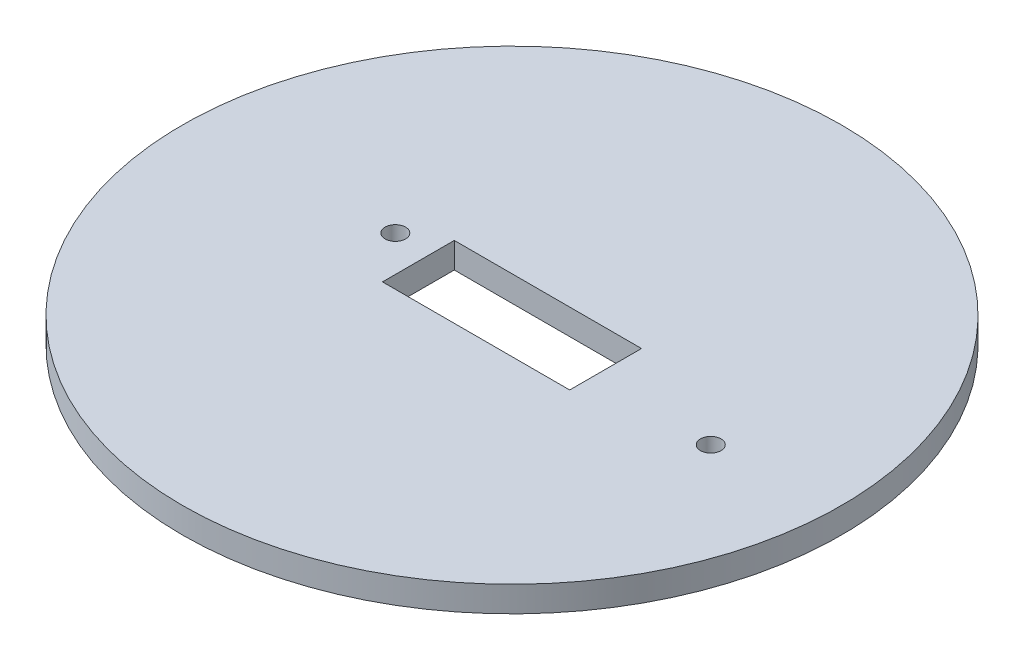
from build123d import *

# Parameters (mm, degrees)
SKETCH2_R                  = 25.7
BOSS_EXTRUDE1_DEPTH        = 2
SKETCH3_W                  = 14.6
SKETCH3_H                  = 5.6
CUT_EXTRUDE1_DEPTH         = 37.400274724
F_1_6_1_6_DIAMETER_HOLE1_D = 1.6


with BuildPart() as part:
    # Sketch2 → Boss-Extrude1 (new body)
    with BuildSketch(Plane(origin=(0, 0, 0), x_dir=(1, 0, 0), z_dir=(0, 1, 0))):
        with Locations(Location((0, 0, 0), (0, 0, 270))):
            Circle(SKETCH2_R)
    extrude(amount=BOSS_EXTRUDE1_DEPTH)

    # Sketch3 → Cut-Extrude1 (cut, through all)
    with BuildSketch(Plane(origin=(0, 2, 0), x_dir=(1, 0, 0), z_dir=(0, 1, 0))):
        Rectangle(SKETCH3_W, SKETCH3_H)
    extrude(amount=-CUT_EXTRUDE1_DEPTH, mode=Mode.SUBTRACT)

    # Ø1.6 (1.6) Diameter Hole1 (through all)
    with Locations(Plane(origin=(-10.1, 2, -1), x_dir=(0, 0, 1), z_dir=(0, 1, 0))):
        with Locations((0, 0), (2, 26.6)):
            Hole(F_1_6_1_6_DIAMETER_HOLE1_D / 2)


solid = part.part
